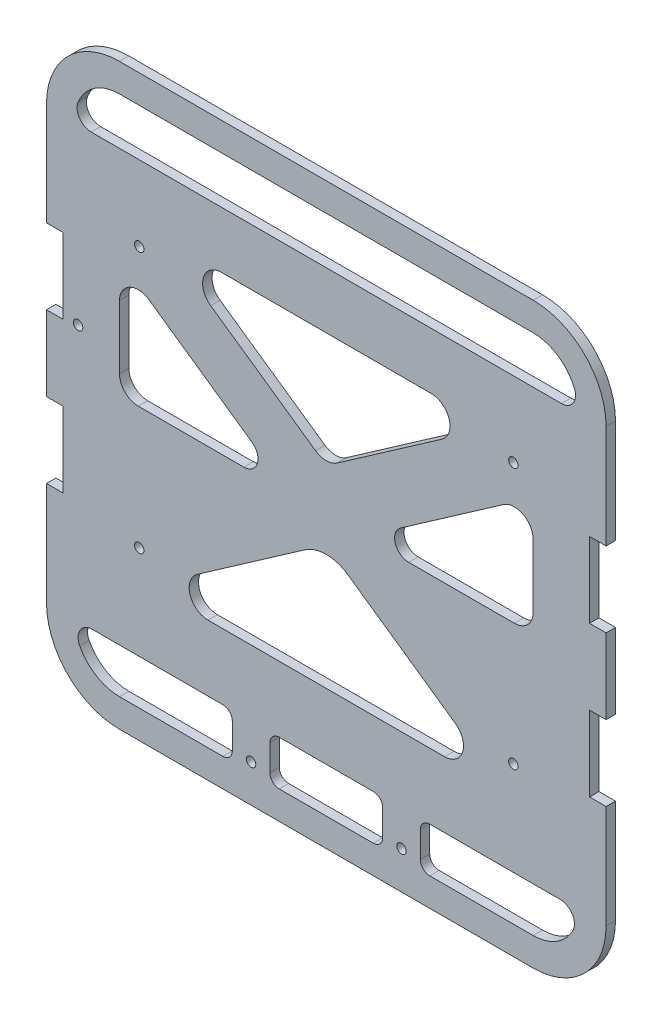
from build123d import *

# Parameters (mm, degrees)
SKETCH1_R           = 1.5875
BOSS_EXTRUDE1_DEPTH = 3.175


with BuildPart() as part:
    # Sketch1 → Boss-Extrude1 (new body)
    with BuildSketch(Plane.XY.offset(-676.275)):
        with BuildLine():
            Line((94.488, -171.45), (94.488, -136.525))
            Line((94.488, -136.525), (88.9, -136.525))
            Line((88.9, -136.525), (88.9, -111.125))
            Line((88.9, -111.125), (94.488, -111.125))
            Line((94.488, -111.125), (94.488, -85.725))
            Line((94.488, -85.725), (88.9, -85.725))
            Line((88.9, -85.725), (88.9, -60.325))
            Line((88.9, -60.325), (94.488, -60.325))
            Line((94.488, -60.325), (94.488, -25.4))
            ThreePointArc((94.488, -25.4), (87.271696875, -7.978303125), (69.85, -0.762))
            Line((69.85, -0.762), (-69.85, -0.762))
            ThreePointArc((-69.85, -0.762), (-87.271696875, -7.978303125), (-94.488, -25.4))
            Line((-94.488, -25.4), (-94.488, -60.325))
            Line((-94.488, -60.325), (-88.9, -60.325))
            Line((-88.9, -60.325), (-88.9, -85.725))
            Line((-88.9, -85.725), (-94.488, -85.725))
            Line((-94.488, -85.725), (-94.488, -111.125))
            Line((-94.488, -111.125), (-88.9, -111.125))
            Line((-88.9, -111.125), (-88.9, -136.525))
            Line((-88.9, -136.525), (-94.488, -136.525))
            Line((-94.488, -136.525), (-94.488, -171.45))
            ThreePointArc((-94.488, -171.45), (-87.271696875, -188.871696875), (-69.85, -196.088))
            Line((-69.85, -196.088), (69.85, -196.088))
            ThreePointArc((69.85, -196.088), (87.271696875, -188.871696875), (94.488, -171.45))
        make_face()
        with Locations(Location((63.1655201, -139.7, 0), (0, 0, 180))):
            Circle(SKETCH1_R, mode=Mode.SUBTRACT)
        with Locations(Location((-83.82, -84.836714101, 0), (0, 0, 180))):
            Circle(SKETCH1_R, mode=Mode.SUBTRACT)
        with Locations(Location((-63.1655201, -51.5992872, 0), (0, 0, 180))):
            Circle(SKETCH1_R, mode=Mode.SUBTRACT)
        with Locations(Location((25.4, -183.388, 0), (0, 0, 180))):
            Circle(SKETCH1_R, mode=Mode.SUBTRACT)
        with Locations(Location((-25.4, -183.388, 0), (0, 0, 180))):
            Circle(SKETCH1_R, mode=Mode.SUBTRACT)
        with Locations(Location((-63.1655201, -139.7, 0), (0, 0, 180))):
            Circle(SKETCH1_R, mode=Mode.SUBTRACT)
        with Locations(Location((63.1655201, -51.5992872, 0), (0, 0, 180))):
            Circle(SKETCH1_R, mode=Mode.SUBTRACT)
        with BuildLine():
            Line((7.264641701, -112.328307791), (43.598023874, -137.666473794))
            ThreePointArc((43.598023874, -137.666473794), (46.023616914, -144.778727737), (39.965703023, -149.225))
            Line((39.965703023, -149.225), (-39.965703023, -149.225))
            ThreePointArc((-39.965703023, -149.225), (-46.023616914, -144.778727737), (-43.598023874, -137.666473794))
            Line((-43.598023874, -137.666473794), (-7.264641701, -112.328307791))
            ThreePointArc((-7.264641701, -112.328307791), (0, -110.045360203), (7.264641701, -112.328307791))
        make_face(mode=Mode.SUBTRACT)
        with BuildLine():
            Line((39.04526783, -56.807813406), (3.632320851, -81.504086518))
            ThreePointArc((3.632320851, -81.504086518), (0, -82.645560312), (-3.632320851, -81.504086518))
            Line((-3.632320851, -81.504086518), (-39.04526783, -56.807813406))
            ThreePointArc((-39.04526783, -56.807813406), (-41.47086087, -49.695559463), (-35.41294698, -45.2492872))
            Line((-35.41294698, -45.2492872), (35.41294698, -45.2492872))
            ThreePointArc((35.41294698, -45.2492872), (41.47086087, -49.695559463), (39.04526783, -56.807813406))
        make_face(mode=Mode.SUBTRACT)
        with BuildLine():
            Line((69.85, -70.72011097), (69.85, -92.075))
            ThreePointArc((69.85, -92.075), (67.990128061, -96.565128061), (63.5, -98.425))
            Line((63.5, -98.425), (27.826758339, -98.425))
            ThreePointArc((27.826758339, -98.425), (23.283322921, -95.090295803), (25.102517701, -89.756105345))
            Line((25.102517701, -89.756105345), (59.867679149, -65.511584764))
            ThreePointArc((59.867679149, -65.511584764), (66.4374532, -65.090380186), (69.85, -70.72011097))
        make_face(mode=Mode.SUBTRACT)
        with BuildLine():
            Line((-59.867679149, -65.511584764), (-25.102517701, -89.756105345))
            ThreePointArc((-25.102517701, -89.756105345), (-23.283322921, -95.090295803), (-27.826758339, -98.425))
            Line((-27.826758339, -98.425), (-63.5, -98.425))
            ThreePointArc((-63.5, -98.425), (-67.990128061, -96.565128061), (-69.85, -92.075))
            Line((-69.85, -92.075), (-69.85, -70.72011097))
            ThreePointArc((-69.85, -70.72011097), (-66.4374532, -65.090380186), (-59.867679149, -65.511584764))
        make_face(mode=Mode.SUBTRACT)
        with BuildLine():
            Line((-69.85, -186.563), (-34.925, -186.563))
            ThreePointArc((-34.925, -186.563), (-32.67993597, -185.63306403), (-31.75, -183.388))
            Line((-31.75, -183.388), (-31.75, -174.625))
            ThreePointArc((-31.75, -174.625), (-32.67993597, -172.37993597), (-34.925, -171.45))
            Line((-34.925, -171.45), (-79.039746678, -171.45))
            ThreePointArc((-79.039746678, -171.45), (-83.108999442, -173.738113573), (-83.268157726, -178.403834356))
            ThreePointArc((-83.268157726, -178.403834356), (-77.702052928, -184.363095439), (-69.85, -186.563))
        make_face(mode=Mode.SUBTRACT)
        with BuildLine():
            Line((69.85, -10.287), (-69.85, -10.287))
            ThreePointArc((-69.85, -10.287), (-78.244855824, -12.833012903), (-83.811231367, -19.613223028))
            ThreePointArc((-83.811231367, -19.613223028), (-83.371868677, -24.08222496), (-79.411683667, -26.1992872))
            Line((-79.411683667, -26.1992872), (79.411683667, -26.1992872))
            ThreePointArc((79.411683667, -26.1992872), (83.371868677, -24.08222496), (83.811231367, -19.613223028))
            ThreePointArc((83.811231367, -19.613223028), (78.244855824, -12.833012903), (69.85, -10.287))
        make_face(mode=Mode.SUBTRACT)
        with BuildLine():
            Line((-19.05, -183.388), (-19.05, -174.625))
            ThreePointArc((-19.05, -174.625), (-18.12006403, -172.37993597), (-15.875, -171.45))
            Line((-15.875, -171.45), (15.875, -171.45))
            ThreePointArc((15.875, -171.45), (18.12006403, -172.37993597), (19.05, -174.625))
            Line((19.05, -174.625), (19.05, -183.388))
            ThreePointArc((19.05, -183.388), (18.12006403, -185.63306403), (15.875, -186.563))
            Line((15.875, -186.563), (-15.875, -186.563))
            ThreePointArc((-15.875, -186.563), (-18.12006403, -185.63306403), (-19.05, -183.388))
        make_face(mode=Mode.SUBTRACT)
        with BuildLine():
            Line((31.75, -174.625), (31.75, -183.388))
            ThreePointArc((31.75, -183.388), (32.67993597, -185.63306403), (34.925, -186.563))
            Line((34.925, -186.563), (69.85, -186.563))
            ThreePointArc((69.85, -186.563), (77.702052928, -184.363095439), (83.268157726, -178.403834356))
            ThreePointArc((83.268157726, -178.403834356), (83.108999442, -173.738113573), (79.039746678, -171.45))
            Line((79.039746678, -171.45), (34.925, -171.45))
            ThreePointArc((34.925, -171.45), (32.67993597, -172.37993597), (31.75, -174.625))
        make_face(mode=Mode.SUBTRACT)
    extrude(amount=-BOSS_EXTRUDE1_DEPTH)


solid = part.part
